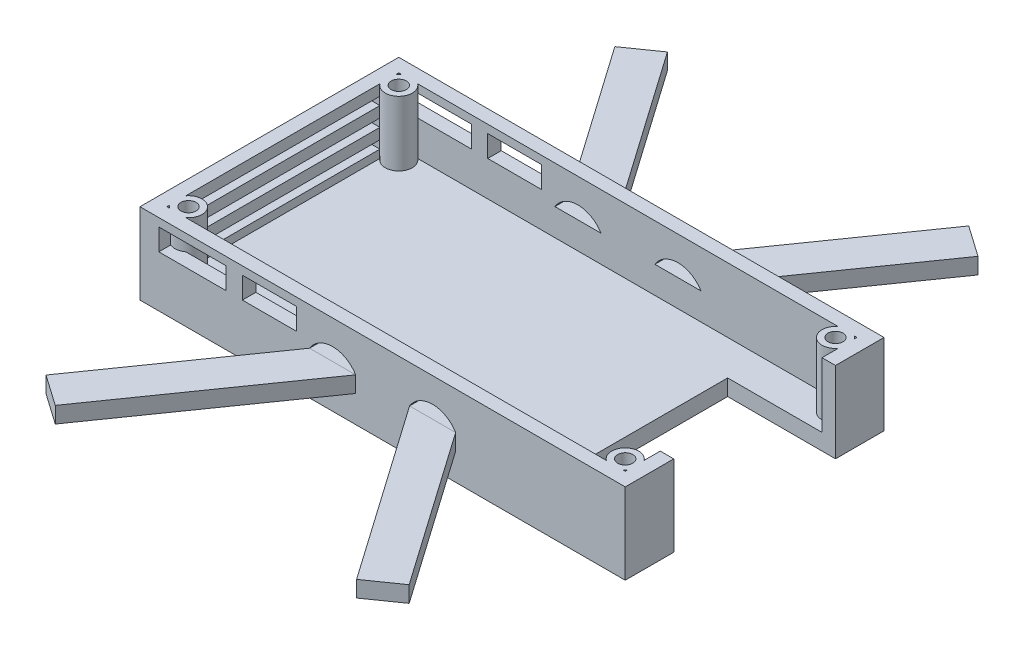
from build123d import *

# Parameters (mm, degrees)
SKICA1_W                  = 90
SKICA1_H                  = 48
P_IDAT_VYSUNUT_M1_DEPTH   = 3
P_IDAT_START              = 5
P_IDAT_VYSUNUT_M2_DEPTH   = 3
P_IDAT_VYSUNUT_M2_2_DEPTH = 3
P_IDAT_VYSUNUT_M2_3_DEPTH = 3
P_IDAT_VYSUNUT_M2_4_DEPTH = 3
SKICA3_W                  = 90
SKICA3_H                  = 48
SKICA3_W_2                = 85
SKICA3_H_2                = 43
P_IDAT_VYSUNUT_M3_DEPTH   = 12
SKICA4_W                  = 30
SKICA4_H                  = 15
ODEBRAT_VYSUNUT_M1_DEPTH  = 20
SKICA10_W                 = 12.5
SKICA10_H                 = 4
SKICA10_W_2               = 10
ODEBRAT_VYSUNUT_M5_DEPTH  = 50
SKICA11_W                 = 36
SKICA11_H                 = 1.5
ODEBRAT_VYSUNUT_M6_DEPTH  = 5
ODEBRAT_VYSUNUT_M7_DEPTH  = 50
SKICA14_R                 = 2.5
SKICA14_R_2               = 1.4
P_IDAT_VYSUNUT_M4_DEPTH   = 12


with BuildPart() as part:
    # Skica1 → Přidat vysunutím1 (new body)
    with BuildSketch(Plane(origin=(0, 0, 0), x_dir=(1, 0, 0), z_dir=(0, 1, 0))):
        Rectangle(SKICA1_W, SKICA1_H)
    extrude(amount=P_IDAT_VYSUNUT_M1_DEPTH)

    # Skica3 → Přidat vysunutím3 (add)
    with BuildSketch(Plane(origin=(0, 3, 0), x_dir=(1, 0, 0), z_dir=(0, 1, 0))):
        Rectangle(SKICA3_W, SKICA3_H)
        Rectangle(SKICA3_W_2, SKICA3_H_2, mode=Mode.SUBTRACT)
    extrude(amount=P_IDAT_VYSUNUT_M3_DEPTH)

    # Skica4 → Odebrat vysunutím1 (cut)
    with BuildSketch(Plane(origin=(45, 0, 0), x_dir=(0, 0, -1), z_dir=(1, 0, 0))):
        with Locations((0, 7.5)):
            Rectangle(SKICA4_W, SKICA4_H)
    extrude(amount=-ODEBRAT_VYSUNUT_M1_DEPTH, mode=Mode.SUBTRACT)

    # Skica10 → Odebrat vysunutím5 (cut)
    with BuildSketch(Plane.XY.offset(24)):
        with Locations((-35.25, 11.5)):
            Rectangle(SKICA10_W, SKICA10_H)
        with Locations((-21, 11.5)):
            Rectangle(SKICA10_W_2, SKICA10_H)
    extrude(amount=-ODEBRAT_VYSUNUT_M5_DEPTH, mode=Mode.SUBTRACT)

    # Skica11 → Odebrat vysunutím6 (cut)
    with BuildSketch(Plane.ZY.offset(45)):
        with Locations((0, 12.25)):
            Rectangle(SKICA11_W, SKICA11_H)
        with Locations((0, 8.75)):
            Rectangle(SKICA11_W, SKICA11_H)
        with Locations((0, 5.25)):
            Rectangle(SKICA11_W, SKICA11_H)
    extrude(amount=-ODEBRAT_VYSUNUT_M6_DEPTH, mode=Mode.SUBTRACT)

    # Skica12 → Odebrat vysunutím7 (cut)
    with BuildSketch(Plane.XY.offset(24)):
        with BuildLine():
            Line((-5, 8), (-13.545422121, 8))
            ThreePointArc((-13.545422121, 8), (-9.272711061, 10.403090261), (-5, 8))
        make_face()
        with BuildLine():
            Line((5, 8), (13.545422121, 8))
            ThreePointArc((13.545422121, 8), (9.272711061, 10.403090261), (5, 8))
        make_face()
    extrude(amount=-ODEBRAT_VYSUNUT_M7_DEPTH, mode=Mode.SUBTRACT)

    # Skica14 → Přidat vysunutím4 (add)
    # profile 1 of 4: a face of its own
    with BuildSketch(Plane(origin=(0, 3, 0), x_dir=(1, 0, 0), z_dir=(0, 1, 0))):
        with Locations((-40.5, 19.5)):
            Circle(SKICA14_R)
        with Locations(Location((-40.5, 19.5, 0), (0, 0, 270))):
            Circle(SKICA14_R_2, mode=Mode.SUBTRACT)
    # profile 2 of 4: a face of its own
    with BuildSketch(Plane(origin=(0, 3, 0), x_dir=(1, 0, 0), z_dir=(0, 1, 0))):
        with Locations((-40.5, -19.5)):
            Circle(SKICA14_R)
        with Locations(Location((-40.5, -19.5, 0), (0, 0, 270))):
            Circle(SKICA14_R_2, mode=Mode.SUBTRACT)
    # profile 3 of 4: a face of its own
    with BuildSketch(Plane(origin=(0, 3, 0), x_dir=(1, 0, 0), z_dir=(0, 1, 0))):
        with Locations((40.5, -19.5)):
            Circle(SKICA14_R)
        with Locations(Location((40.5, -19.5, 0), (0, 0, 270))):
            Circle(SKICA14_R_2, mode=Mode.SUBTRACT)
    # profile 4 of 4: a face of its own
    with BuildSketch(Plane(origin=(0, 3, 0), x_dir=(1, 0, 0), z_dir=(0, 1, 0))):
        with Locations((40.5, 19.5)):
            Circle(SKICA14_R)
        with Locations(Location((40.5, 19.5, 0), (0, 0, 270))):
            Circle(SKICA14_R_2, mode=Mode.SUBTRACT)
    extrude(amount=P_IDAT_VYSUNUT_M4_DEPTH)


with BuildPart() as body_2:
    # Skica2 → Přidat vysunutím2 (new body)
    with BuildSketch(Plane(origin=(0, 0, 0), x_dir=(1, 0, 0), z_dir=(0, 1, 0)).offset(P_IDAT_START)):
        Polygon((-33.677121764, -52.751046717), (-13.545422121, -24), (-11.103872944, -24), (-5, -24), (-27.943057454, -56.766081772), align=None)
    extrude(amount=P_IDAT_VYSUNUT_M2_DEPTH)


with BuildPart() as body_3:
    # Skica2 → P_idat vysunut_m2 2 (new body)
    with BuildSketch(Plane(origin=(0, 0, 0), x_dir=(1, 0, 0), z_dir=(0, 1, 0)).offset(P_IDAT_START)):
        Polygon((5, -24), (27.943057454, -56.766081772), (33.677121764, -52.751046717), (13.545422121, -24), (11.103872944, -24), align=None)
    extrude(amount=P_IDAT_VYSUNUT_M2_2_DEPTH)


with BuildPart() as body_4:
    # Skica2 → P_idat vysunut_m2 3 (new body)
    with BuildSketch(Plane(origin=(0, 0, 0), x_dir=(1, 0, 0), z_dir=(0, 1, 0)).offset(P_IDAT_START)):
        Polygon((-5, 24), (-27.943057454, 56.766081772), (-33.677121764, 52.751046717), (-13.545422121, 24), (-11.103872944, 24), align=None)
    extrude(amount=P_IDAT_VYSUNUT_M2_3_DEPTH)


with BuildPart() as body_5:
    # Skica2 → P_idat vysunut_m2 4 (new body)
    with BuildSketch(Plane(origin=(0, 0, 0), x_dir=(1, 0, 0), z_dir=(0, 1, 0)).offset(P_IDAT_START)):
        Polygon((5, 24), (27.943057454, 56.766081772), (33.677121764, 52.751046717), (13.545422121, 24), (11.103872944, 24), align=None)
    extrude(amount=P_IDAT_VYSUNUT_M2_4_DEPTH)


solid = Compound([part.part, body_2.part, body_3.part, body_4.part, body_5.part])
